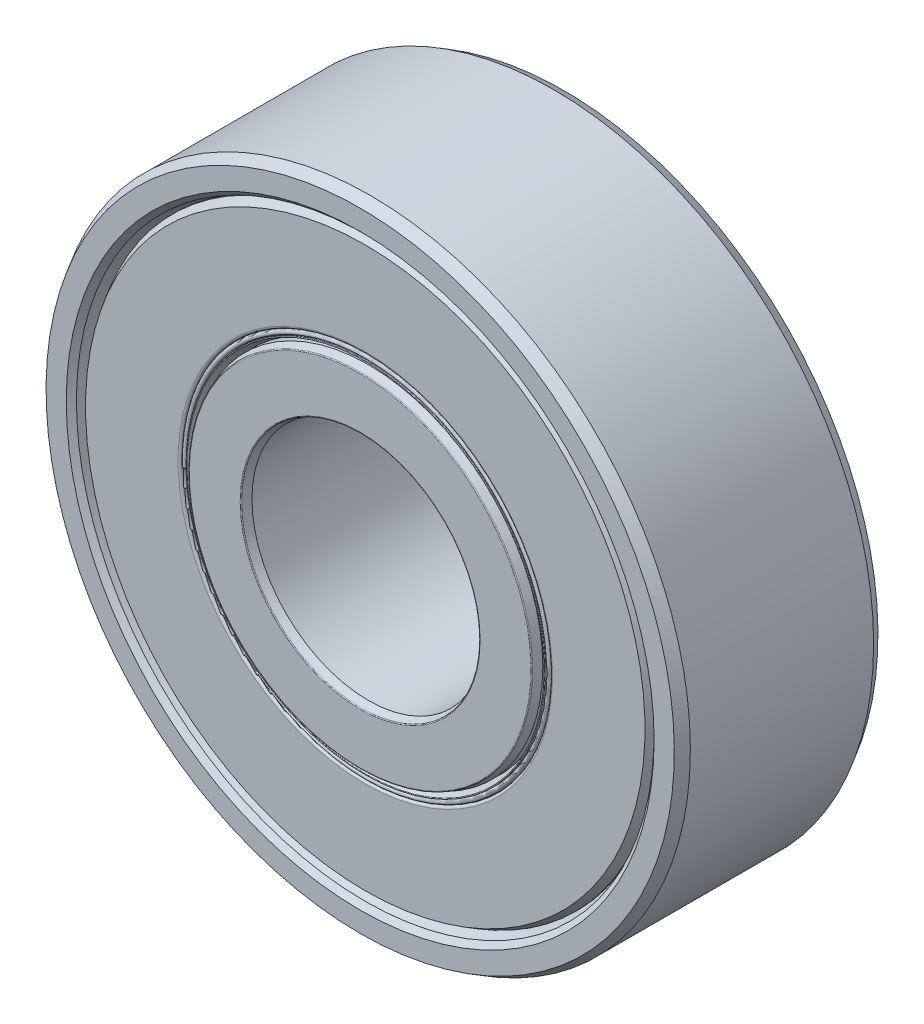
from build123d import *

# Parameters (mm, degrees)
CIRPATTERN1_COUNT = 7


with BuildPart() as part:
    # Sketch3 → Revolve1 (revolve)
    with BuildSketch(Plane(origin=(0, 0, 0), x_dir=(0, 0, -1), z_dir=(1, 0, 0)), mode=Mode.PRIVATE) as revolve1_sk:
        with BuildLine():
            Line((-2.945227749, 9.79), (-3.325, 9.928225795))
            Line((-3.325, 9.928225795), (-3.5, 10.103225795))
            Line((-3.5, 10.103225795), (-3.5, 10.797927406))
            Line((-3.5, 10.797927406), (-3.15, 11))
            Line((-3.15, 11), (3.15, 11))
            Line((3.15, 11), (3.5, 10.797927406))
            Line((3.5, 10.797927406), (3.5, 10.103225795))
            Line((3.5, 10.103225795), (3.325, 9.928225795))
            Line((3.325, 9.928225795), (2.945227749, 9.79))
            Line((2.945227749, 9.79), (1.631, 9.79))
            ThreePointArc((1.631, 9.79), (0, 10.395), (-1.631, 9.79))
            Line((-1.631, 9.79), (-2.945227749, 9.79))
        make_face()
    revolve(revolve1_sk.sketch.rotate(Axis((0, 0, 3.5), (0, 0, -1)), 180), axis=Axis((0, 0, 3.5), (0, 0, -1)))


with BuildPart() as body_2:
    # Sketch4 → Revolve2 (revolve)
    with BuildSketch(Plane(origin=(0, 0, 0), x_dir=(0, 0, -1), z_dir=(1, 0, 0)), mode=Mode.PRIVATE) as revolve2_sk:
        with BuildLine():
            Line((-3.22, 4), (-3.476970705, 4.093529688))
            ThreePointArc((-3.476970705, 4.093529688), (-3.493670322, 4.106343754), (-3.5, 4.126418929))
            Line((-3.5, 4.126418929), (-3.5, 5.87162074))
            ThreePointArc((-3.5, 5.87162074), (-3.493670322, 5.891695915), (-3.476970705, 5.904509982))
            Line((-3.476970705, 5.904509982), (-3.22, 5.998039669))
            Line((-3.22, 5.998039669), (-1.631, 5.998039669))
            ThreePointArc((-1.631, 5.998039669), (0, 5.393039669), (1.631, 5.998039669))
            Line((1.631, 5.998039669), (3.22, 5.998039669))
            Line((3.22, 5.998039669), (3.476970705, 5.904509982))
            ThreePointArc((3.476970705, 5.904509982), (3.493670322, 5.891695915), (3.5, 5.87162074))
            Line((3.5, 5.87162074), (3.5, 4.126418929))
            ThreePointArc((3.5, 4.126418929), (3.493670322, 4.106343754), (3.476970705, 4.093529688))
            Line((3.476970705, 4.093529688), (3.22, 4))
            Line((3.22, 4), (-3.22, 4))
        make_face()
    revolve(revolve2_sk.sketch.rotate(Axis((0, 0, 3.5), (0, 0, -1)), 180), axis=Axis((0, 0, 3.5), (0, 0, -1)))


with BuildPart() as body_3:
    # Sketch5 → Revolve3 (revolve)
    with BuildSketch(Plane(origin=(0, 0, 0), x_dir=(0, 0, -1), z_dir=(1, 0, 0))):
        with BuildLine():
            Line((-2.500980165, 7.894019835), (2.500980165, 7.894019835))
            ThreePointArc((2.500980165, 7.894019835), (0, 10.395), (-2.500980165, 7.894019835))
        make_face()
    revolve(axis=Axis((0, 7.894019835, 2.500980165), (0, 0, -1)))


with BuildPart() as cirpattern1_1:
    # CirPattern1: pattern copy
    add(body_3.part.rotate(Axis((0, 0, 0), (0, 0, 1)), 1 * 360 / CIRPATTERN1_COUNT))


with BuildPart() as cirpattern1_2:
    # CirPattern1: pattern copy
    add(body_3.part.rotate(Axis((0, 0, 0), (0, 0, 1)), 2 * 360 / CIRPATTERN1_COUNT))


with BuildPart() as cirpattern1_3:
    # CirPattern1: pattern copy
    add(body_3.part.rotate(Axis((0, 0, 0), (0, 0, 1)), 3 * 360 / CIRPATTERN1_COUNT))


with BuildPart() as cirpattern1_4:
    # CirPattern1: pattern copy
    add(body_3.part.rotate(Axis((0, 0, 0), (0, 0, 1)), 4 * 360 / CIRPATTERN1_COUNT))


with BuildPart() as cirpattern1_5:
    # CirPattern1: pattern copy
    add(body_3.part.rotate(Axis((0, 0, 0), (0, 0, 1)), 5 * 360 / CIRPATTERN1_COUNT))


with BuildPart() as cirpattern1_6:
    # CirPattern1: pattern copy
    add(body_3.part.rotate(Axis((0, 0, 0), (0, 0, 1)), 6 * 360 / CIRPATTERN1_COUNT))


with BuildPart() as body_10:
    # Sketch6 → Revolve4 (revolve)
    with BuildSketch(Plane(origin=(0, 0, 0), x_dir=(0, 0, -1), z_dir=(1, 0, 0)), mode=Mode.PRIVATE) as revolve4_sk:
        with BuildLine():
            Line((-3.021891109, 9.79), (-2.500980165, 9.79))
            Line((-2.500980165, 9.79), (-2.500980165, 6.348039669))
            Line((-2.500980165, 6.348039669), (-3.2375, 6.348039669))
            ThreePointArc((-3.2375, 6.348039669), (-3.299371843, 6.373667826), (-3.325, 6.435539669))
            Line((-3.325, 6.435539669), (-3.325, 9.615))
            Line((-3.325, 9.615), (-3.021891109, 9.79))
        make_face()
        with BuildLine():
            Line((3.2375, 6.348039669), (2.500980165, 6.348039669))
            Line((2.500980165, 6.348039669), (2.500980165, 9.79))
            Line((2.500980165, 9.79), (3.021891109, 9.79))
            Line((3.021891109, 9.79), (3.325, 9.615))
            Line((3.325, 9.615), (3.325, 6.435539669))
            ThreePointArc((3.325, 6.435539669), (3.299371843, 6.373667826), (3.2375, 6.348039669))
        make_face()
    revolve(revolve4_sk.sketch.rotate(Axis((0, 0, 3.5), (0, 0, -1)), 180), axis=Axis((0, 0, 3.5), (0, 0, -1)))


with BuildPart() as body_11:
    # Sketch7 → Revolve5 (revolve)
    with BuildSketch(Plane(origin=(0, 0, 0), x_dir=(0, 0, -1), z_dir=(1, 0, 0)), mode=Mode.PRIVATE) as revolve5_sk:
        with BuildLine():
            Line((-2.500980165, 5.998039669), (-2.925938883, 5.998039669))
            Line((-2.925938883, 5.998039669), (-3.313485353, 6.139095049))
            ThreePointArc((-3.313485353, 6.139095049), (-3.324734136, 6.158578513), (-3.3075, 6.173039669))
            Line((-3.3075, 6.173039669), (-3.2375, 6.173039669))
            ThreePointArc((-3.2375, 6.173039669), (-3.325, 6.260539669), (-3.2375, 6.348039669))
            Line((-3.2375, 6.348039669), (-2.500980165, 6.348039669))
            Line((-2.500980165, 6.348039669), (-2.500980165, 5.998039669))
        make_face()
        with BuildLine():
            Line((2.500980165, 6.348039669), (2.500980165, 5.998039669))
            Line((2.500980165, 5.998039669), (2.925938883, 5.998039669))
            Line((2.925938883, 5.998039669), (3.313485353, 6.139095049))
            ThreePointArc((3.313485353, 6.139095049), (3.324734136, 6.158578513), (3.3075, 6.173039669))
            Line((3.3075, 6.173039669), (3.2375, 6.173039669))
            ThreePointArc((3.2375, 6.173039669), (3.325, 6.260539669), (3.2375, 6.348039669))
            Line((3.2375, 6.348039669), (2.500980165, 6.348039669))
        make_face()
    revolve(revolve5_sk.sketch.rotate(Axis((0, 0, 3.5), (0, 0, -1)), 180), axis=Axis((0, 0, 3.5), (0, 0, -1)))


solid = Compound([part.part, body_2.part, body_3.part, cirpattern1_1.part, cirpattern1_2.part, cirpattern1_3.part, cirpattern1_4.part, cirpattern1_5.part, cirpattern1_6.part, body_10.part, body_11.part])
